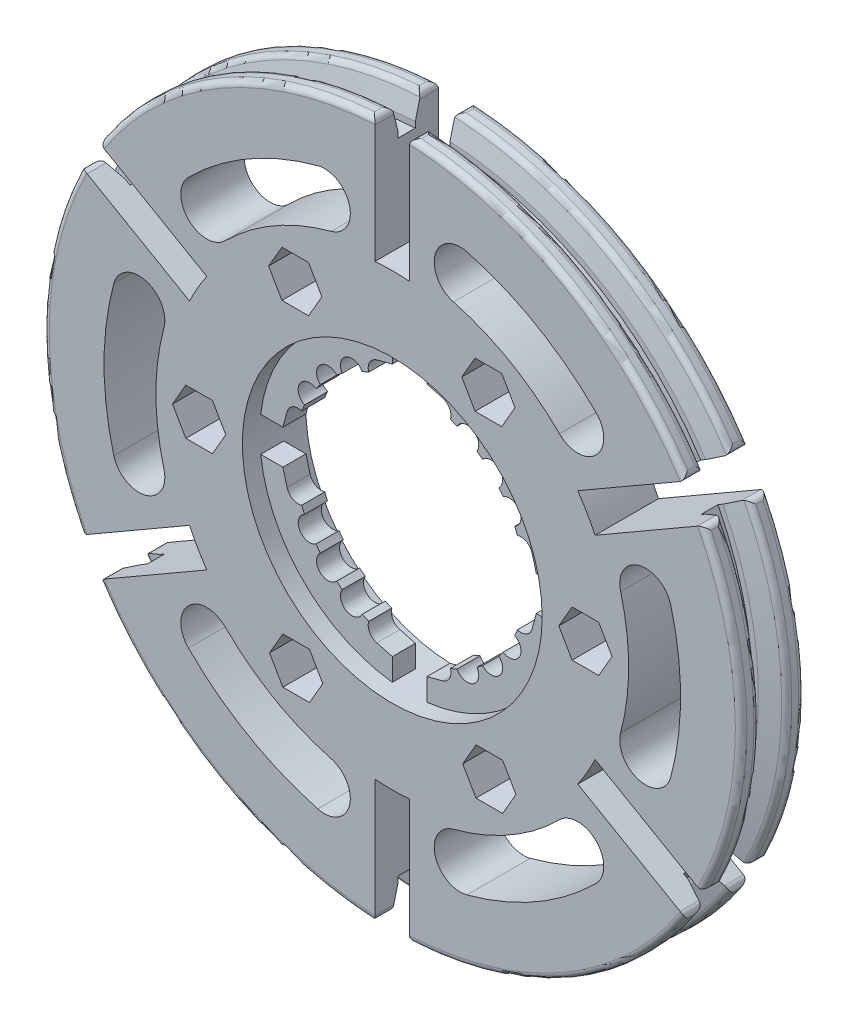
from build123d import *
from OCP.BRepFilletAPI import BRepFilletAPI_MakeChamfer

# Parameters (mm, degrees)
SKETCH_1_R          = 13
EXTRUDE_1_DEPTH     = 5.5
CUT_EXTRUDE_START   = -2
SKETCH_2_R          = 30.25
SKETCH_2_R_2        = 27.75
CUT_EXTRUDE_1_DEPTH = 1.5
CHAMFER_1_SIZE      = 2
CHAMFER_1_SIZE2     = 0.5
CHAMFER_2_SIZE      = 0.5
CHAMFER_2_SIZE2     = 2
FILLET_1_R          = 0.5
CUT_EXTRUDE_2_REACH = 45.085
CUT_EXTRUDE_3_REACH = 45.085
EXTRUDE_START       = -1.5
EXTRUDE_5_DEPTH     = 2
CUT_EXTRUDE_4_REACH = 44.919


with BuildPart() as part:
    # 草图1 → 凸台-拉伸1 (new body)
    with BuildSketch(Plane.XY):
        with BuildLine():
            Line((-1.5, 19.442222095), (-1.5, 30.212787028))
            ThreePointArc((-1.5, 30.212787028), (-15.125, 26.197268464), (-25.415041085, 16.40543162))
            Line((-25.415041085, 16.40543162), (-16.08745824, 11.020149153))
            ThreePointArc((-16.08745824, 11.020149153), (-16.887495374, 9.75), (-17.58745824, 8.422072942))
            Line((-17.58745824, 8.422072942), (-26.915041085, 13.807355408))
            ThreePointArc((-26.915041085, 13.807355408), (-30.25, 0), (-26.915041085, -13.807355408))
            Line((-26.915041085, -13.807355408), (-17.58745824, -8.422072942))
            ThreePointArc((-17.58745824, -8.422072942), (-16.887495374, -9.75), (-16.08745824, -11.020149153))
            Line((-16.08745824, -11.020149153), (-25.415041085, -16.40543162))
            ThreePointArc((-25.415041085, -16.40543162), (-15.125, -26.197268464), (-1.5, -30.212787028))
            Line((-1.5, -30.212787028), (-1.5, -19.442222095))
            ThreePointArc((-1.5, -19.442222095), (0, -19.5), (1.5, -19.442222095))
            Line((1.5, -19.442222095), (1.5, -30.212787028))
            ThreePointArc((1.5, -30.212787028), (15.125, -26.197268464), (25.415041085, -16.40543162))
            Line((25.415041085, -16.40543162), (16.08745824, -11.020149153))
            ThreePointArc((16.08745824, -11.020149153), (16.887495374, -9.75), (17.58745824, -8.422072942))
            Line((17.58745824, -8.422072942), (26.915041085, -13.807355408))
            ThreePointArc((26.915041085, -13.807355408), (30.25, 0), (26.915041085, 13.807355408))
            Line((26.915041085, 13.807355408), (17.58745824, 8.422072942))
            ThreePointArc((17.58745824, 8.422072942), (16.887495374, 9.75), (16.08745824, 11.020149153))
            Line((16.08745824, 11.020149153), (25.415041085, 16.40543162))
            ThreePointArc((25.415041085, 16.40543162), (15.125, 26.197268464), (1.5, 30.212787028))
            Line((1.5, 30.212787028), (1.5, 19.442222095))
            ThreePointArc((1.5, 19.442222095), (0, 19.5), (-1.5, 19.442222095))
        make_face()
        Circle(SKETCH_1_R, mode=Mode.SUBTRACT)
    extrude(amount=-EXTRUDE_1_DEPTH)

    # 草图2 → 切除-拉伸1 (cut)
    with BuildSketch(Plane.XY.offset(CUT_EXTRUDE_START)):
        Circle(SKETCH_2_R)
        Circle(SKETCH_2_R_2, mode=Mode.SUBTRACT)
    extrude(amount=-CUT_EXTRUDE_1_DEPTH, mode=Mode.SUBTRACT)

    # 倒角1: one chamfer whose edges measure the first distance from different faces: ONE call of the kernel's chamfer builder (chamfer() names one face for all edges)
    chamfer_1_edges_1 = [part.edges().sort_by_distance(p)[0] for p in [
        (15.125, -26.197268464, -2),
    ]]
    chamfer_1_side_1 = [part.faces().sort_by_distance(p)[0] for p in [
        (13.977418877, -24.209599654, -2),
    ]]
    chamfer_1_edges_2 = [part.edges().sort_by_distance(p)[0] for p in [
        (-15.125, -26.197268464, -2),
    ]]
    chamfer_1_side_2 = [part.faces().sort_by_distance(p)[0] for p in [
        (-13.977418877, -24.209599654, -2),
    ]]
    chamfer_1_edges_3 = [part.edges().sort_by_distance(p)[0] for p in [
        (-30.25, 0, -2),
    ]]
    chamfer_1_side_3 = [part.faces().sort_by_distance(p)[0] for p in [
        (-27.954837754, 0, -2),
    ]]
    chamfer_1_edges_4 = [part.edges().sort_by_distance(p)[0] for p in [
        (-15.125, 26.197268464, -2),
    ]]
    chamfer_1_side_4 = [part.faces().sort_by_distance(p)[0] for p in [
        (-13.977418877, 24.209599654, -2),
    ]]
    chamfer_1_edges_5 = [part.edges().sort_by_distance(p)[0] for p in [
        (15.125, 26.197268464, -2),
    ]]
    chamfer_1_side_5 = [part.faces().sort_by_distance(p)[0] for p in [
        (13.977418877, 24.209599654, -2),
    ]]
    chamfer_1_edges_6 = [part.edges().sort_by_distance(p)[0] for p in [
        (30.25, 0, -2),
    ]]
    chamfer_1_side_6 = [part.faces().sort_by_distance(p)[0] for p in [
        (27.954837754, 0, -2),
    ]]
    chamfer_1 = BRepFilletAPI_MakeChamfer(part.part.solid().wrapped)
    for e in chamfer_1_edges_1:
        chamfer_1.Add(CHAMFER_1_SIZE, CHAMFER_1_SIZE2, e.wrapped, chamfer_1_side_1[0].wrapped)  # the first distance lies on this face
    for e in chamfer_1_edges_2:
        chamfer_1.Add(CHAMFER_1_SIZE, CHAMFER_1_SIZE2, e.wrapped, chamfer_1_side_2[0].wrapped)  # the first distance lies on this face
    for e in chamfer_1_edges_3:
        chamfer_1.Add(CHAMFER_1_SIZE, CHAMFER_1_SIZE2, e.wrapped, chamfer_1_side_3[0].wrapped)  # the first distance lies on this face
    for e in chamfer_1_edges_4:
        chamfer_1.Add(CHAMFER_1_SIZE, CHAMFER_1_SIZE2, e.wrapped, chamfer_1_side_4[0].wrapped)  # the first distance lies on this face
    for e in chamfer_1_edges_5:
        chamfer_1.Add(CHAMFER_1_SIZE, CHAMFER_1_SIZE2, e.wrapped, chamfer_1_side_5[0].wrapped)  # the first distance lies on this face
    for e in chamfer_1_edges_6:
        chamfer_1.Add(CHAMFER_1_SIZE, CHAMFER_1_SIZE2, e.wrapped, chamfer_1_side_6[0].wrapped)  # the first distance lies on this face
    add(Compound.cast(chamfer_1.Shape()), mode=Mode.REPLACE)

    # 倒角2: one chamfer whose edges measure the first distance from different faces: ONE call of the kernel's chamfer builder (chamfer() names one face for all edges)
    chamfer_2_edges_1 = [part.edges().sort_by_distance(p)[0] for p in [
        (15.125, 26.197268464, -3.5),
    ]]
    chamfer_2_side_1 = [part.faces().sort_by_distance(p)[0] for p in [
        (15.125, 26.197268464, -4.5),
    ]]
    chamfer_2_edges_2 = [part.edges().sort_by_distance(p)[0] for p in [
        (30.25, 0, -3.5),
    ]]
    chamfer_2_side_2 = [part.faces().sort_by_distance(p)[0] for p in [
        (30.25, 0, -4.5),
    ]]
    chamfer_2_edges_3 = [part.edges().sort_by_distance(p)[0] for p in [
        (15.125, -26.197268464, -3.5),
    ]]
    chamfer_2_side_3 = [part.faces().sort_by_distance(p)[0] for p in [
        (15.125, -26.197268464, -4.5),
    ]]
    chamfer_2_edges_4 = [part.edges().sort_by_distance(p)[0] for p in [
        (-15.125, -26.197268464, -3.5),
    ]]
    chamfer_2_side_4 = [part.faces().sort_by_distance(p)[0] for p in [
        (-15.125, -26.197268464, -4.5),
    ]]
    chamfer_2_edges_5 = [part.edges().sort_by_distance(p)[0] for p in [
        (-30.25, 0, -3.5),
    ]]
    chamfer_2_side_5 = [part.faces().sort_by_distance(p)[0] for p in [
        (-30.25, 0, -4.5),
    ]]
    chamfer_2_edges_6 = [part.edges().sort_by_distance(p)[0] for p in [
        (-15.125, 26.197268464, -3.5),
    ]]
    chamfer_2_side_6 = [part.faces().sort_by_distance(p)[0] for p in [
        (-15.125, 26.197268464, -4.5),
    ]]
    chamfer_2 = BRepFilletAPI_MakeChamfer(part.part.solid().wrapped)
    for e in chamfer_2_edges_1:
        chamfer_2.Add(CHAMFER_2_SIZE, CHAMFER_2_SIZE2, e.wrapped, chamfer_2_side_1[0].wrapped)  # the first distance lies on this face
    for e in chamfer_2_edges_2:
        chamfer_2.Add(CHAMFER_2_SIZE, CHAMFER_2_SIZE2, e.wrapped, chamfer_2_side_2[0].wrapped)  # the first distance lies on this face
    for e in chamfer_2_edges_3:
        chamfer_2.Add(CHAMFER_2_SIZE, CHAMFER_2_SIZE2, e.wrapped, chamfer_2_side_3[0].wrapped)  # the first distance lies on this face
    for e in chamfer_2_edges_4:
        chamfer_2.Add(CHAMFER_2_SIZE, CHAMFER_2_SIZE2, e.wrapped, chamfer_2_side_4[0].wrapped)  # the first distance lies on this face
    for e in chamfer_2_edges_5:
        chamfer_2.Add(CHAMFER_2_SIZE, CHAMFER_2_SIZE2, e.wrapped, chamfer_2_side_5[0].wrapped)  # the first distance lies on this face
    for e in chamfer_2_edges_6:
        chamfer_2.Add(CHAMFER_2_SIZE, CHAMFER_2_SIZE2, e.wrapped, chamfer_2_side_6[0].wrapped)  # the first distance lies on this face
    add(Compound.cast(chamfer_2.Shape()), mode=Mode.REPLACE)

    # 圆角1
    fillet_1_edges = [part.edges().sort_by_distance(p)[0] for p in [
        (15.125, 26.197268464, -1.5),
        (15.125, 26.197268464, 0),
        (30.25, 0, -5.5),
        (26.915041085, -13.807355408, -4.75),
        (30.25, 0, -4),
        (26.915041085, 13.807355408, -4.75),
        (15.125, -26.197268464, -5.5),
        (1.5, -30.212787028, -4.75),
        (15.125, -26.197268464, -4),
        (25.415041085, -16.40543162, -4.75),
        (-15.125, -26.197268464, -5.5),
        (-25.415041085, -16.40543162, -4.75),
        (-15.125, -26.197268464, -4),
        (-1.5, -30.212787028, -4.75),
        (-30.25, 0, -5.5),
        (-26.915041085, 13.807355408, -4.75),
        (-30.25, 0, -4),
        (-26.915041085, -13.807355408, -4.75),
        (15.125, 26.197268464, -5.5),
        (25.415041085, 16.40543162, -4.75),
        (15.125, 26.197268464, -4),
        (1.5, 30.212787028, -4.75),
        (-15.125, 26.197268464, -5.5),
        (-1.5, 30.212787028, -4.75),
        (-15.125, 26.197268464, -4),
        (-25.415041085, 16.40543162, -4.75),
        (-15.125, 26.197268464, 0),
        (-25.415041085, 16.40543162, -0.75),
        (-15.125, 26.197268464, -1.5),
        (-1.5, 30.212787028, -0.75),
        (-30.25, 0, 0),
        (-26.915041085, -13.807355408, -0.75),
        (-30.25, 0, -1.5),
        (-26.915041085, 13.807355408, -0.75),
        (-15.125, -26.197268464, 0),
        (-1.5, -30.212787028, -0.75),
        (-15.125, -26.197268464, -1.5),
        (-25.415041085, -16.40543162, -0.75),
        (15.125, -26.197268464, 0),
        (25.415041085, -16.40543162, -0.75),
        (15.125, -26.197268464, -1.5),
        (1.5, -30.212787028, -0.75),
        (30.25, 0, 0),
        (26.915041085, 13.807355408, -0.75),
        (30.25, 0, -1.5),
        (26.915041085, -13.807355408, -0.75),
        (1.5, 30.212787028, -0.75),
        (25.415041085, 16.40543162, -0.75),
    ]]
    fillet(fillet_1_edges, radius=FILLET_1_R)

    # 草图3 → 切除-拉伸2 (cut, up to next)
    with BuildSketch(Plane.XY, mode=Mode.PRIVATE) as cut_extrude_2_sk1:
        with BuildLine():
            ThreePointArc((14.495689014, 14.495689014), (10.25, 17.753520778), (5.305790425, 19.801479439))
            ThreePointArc((5.305790425, 19.801479439), (3.714800167, 22.5571554), (6.470476128, 24.148145657))
            ThreePointArc((6.470476128, 24.148145657), (12.5, 21.650635095), (17.67766953, 17.67766953))
            ThreePointArc((17.67766953, 17.67766953), (17.67766953, 14.495689014), (14.495689014, 14.495689014))
        make_face()
    cut_extrude_2_tool1 = extrude(cut_extrude_2_sk1.sketch, amount=-CUT_EXTRUDE_2_REACH, mode=Mode.PRIVATE) & part.part
    # 草图3 → 切除-拉伸2 (cut, up to next)
    with BuildSketch(Plane.XY, mode=Mode.PRIVATE) as cut_extrude_2_sk2:
        with BuildLine():
            ThreePointArc((19.801479439, -5.305790425), (20.5, 0), (19.801479439, 5.305790425))
            ThreePointArc((19.801479439, 5.305790425), (21.392469697, 8.061466385), (24.148145657, 6.470476128))
            ThreePointArc((24.148145657, 6.470476128), (25, 0), (24.148145657, -6.470476128))
            ThreePointArc((24.148145657, -6.470476128), (21.392469697, -8.061466385), (19.801479439, -5.305790425))
        make_face()
    cut_extrude_2_tool2 = extrude(cut_extrude_2_sk2.sketch, amount=-CUT_EXTRUDE_2_REACH, mode=Mode.PRIVATE) & part.part
    # 草图3 → 切除-拉伸2 (cut, up to next)
    with BuildSketch(Plane.XY, mode=Mode.PRIVATE) as cut_extrude_2_sk3:
        with BuildLine():
            ThreePointArc((5.305790425, -19.801479439), (10.25, -17.753520778), (14.495689014, -14.495689014))
            ThreePointArc((14.495689014, -14.495689014), (17.67766953, -14.495689014), (17.67766953, -17.67766953))
            ThreePointArc((17.67766953, -17.67766953), (12.5, -21.650635095), (6.470476128, -24.148145657))
            ThreePointArc((6.470476128, -24.148145657), (3.714800167, -22.5571554), (5.305790425, -19.801479439))
        make_face()
    cut_extrude_2_tool3 = extrude(cut_extrude_2_sk3.sketch, amount=-CUT_EXTRUDE_2_REACH, mode=Mode.PRIVATE) & part.part
    # 草图3 → 切除-拉伸2 (cut, up to next)
    with BuildSketch(Plane.XY, mode=Mode.PRIVATE) as cut_extrude_2_sk4:
        with BuildLine():
            ThreePointArc((-14.495689014, -14.495689014), (-10.25, -17.753520778), (-5.305790425, -19.801479439))
            ThreePointArc((-5.305790425, -19.801479439), (-3.714800167, -22.5571554), (-6.470476128, -24.148145657))
            ThreePointArc((-6.470476128, -24.148145657), (-12.5, -21.650635095), (-17.67766953, -17.67766953))
            ThreePointArc((-17.67766953, -17.67766953), (-17.67766953, -14.495689014), (-14.495689014, -14.495689014))
        make_face()
    cut_extrude_2_tool4 = extrude(cut_extrude_2_sk4.sketch, amount=-CUT_EXTRUDE_2_REACH, mode=Mode.PRIVATE) & part.part
    # 草图3 → 切除-拉伸2 (cut, up to next)
    with BuildSketch(Plane.XY, mode=Mode.PRIVATE) as cut_extrude_2_sk5:
        with BuildLine():
            ThreePointArc((-19.801479439, 5.305790425), (-20.5, 0), (-19.801479439, -5.305790425))
            ThreePointArc((-19.801479439, -5.305790425), (-21.392469697, -8.061466385), (-24.148145657, -6.470476128))
            ThreePointArc((-24.148145657, -6.470476128), (-25, 0), (-24.148145657, 6.470476128))
            ThreePointArc((-24.148145657, 6.470476128), (-21.392469697, 8.061466385), (-19.801479439, 5.305790425))
        make_face()
    cut_extrude_2_tool5 = extrude(cut_extrude_2_sk5.sketch, amount=-CUT_EXTRUDE_2_REACH, mode=Mode.PRIVATE) & part.part
    # 草图3 → 切除-拉伸2 (cut, up to next)
    with BuildSketch(Plane.XY, mode=Mode.PRIVATE) as cut_extrude_2_sk6:
        with BuildLine():
            ThreePointArc((-5.305790425, 19.801479439), (-10.25, 17.753520778), (-14.495689014, 14.495689014))
            ThreePointArc((-14.495689014, 14.495689014), (-17.67766953, 14.495689014), (-17.67766953, 17.67766953))
            ThreePointArc((-17.67766953, 17.67766953), (-12.5, 21.650635095), (-6.470476128, 24.148145657))
            ThreePointArc((-6.470476128, 24.148145657), (-3.714800167, 22.5571554), (-5.305790425, 19.801479439))
        make_face()
    cut_extrude_2_tool6 = extrude(cut_extrude_2_sk6.sketch, amount=-CUT_EXTRUDE_2_REACH, mode=Mode.PRIVATE) & part.part
    add(cut_extrude_2_tool1.solids().sort_by_distance((11.186449, 19.375499, 0))[0], mode=Mode.SUBTRACT)
    add(cut_extrude_2_tool2.solids().sort_by_distance((22.372899, 0, 0))[0], mode=Mode.SUBTRACT)
    add(cut_extrude_2_tool3.solids().sort_by_distance((11.186449, -19.375499, 0))[0], mode=Mode.SUBTRACT)
    add(cut_extrude_2_tool4.solids().sort_by_distance((-11.186449, -19.375499, 0))[0], mode=Mode.SUBTRACT)
    add(cut_extrude_2_tool5.solids().sort_by_distance((-22.372899, 0, 0))[0], mode=Mode.SUBTRACT)
    add(cut_extrude_2_tool6.solids().sort_by_distance((-11.186449, 19.375499, 0))[0], mode=Mode.SUBTRACT)

    # 草图4 → 切除-拉伸3 (cut, up to next)
    with BuildSketch(Plane.XY, mode=Mode.PRIVATE) as cut_extrude_3_sk1:
        Polygon((9.490232057, 16.528641172), (7.180830981, 16.528641172), (6.026130442, 14.528641172), (7.180830981, 12.528641172), (9.490232057, 12.528641172), (10.644932596, 14.528641172), align=None)
    cut_extrude_3_tool1 = extrude(cut_extrude_3_sk1.sketch, amount=-CUT_EXTRUDE_3_REACH, mode=Mode.PRIVATE) & part.part
    # 草图4 → 切除-拉伸3 (cut, up to next)
    with BuildSketch(Plane.XY, mode=Mode.PRIVATE) as cut_extrude_3_sk2:
        Polygon((-9.569107116, 16.483102635), (-10.723807654, 14.483102635), (-9.569107116, 12.483102635), (-7.259706039, 12.483102635), (-6.105005501, 14.483102635), (-7.259706039, 16.483102635), align=None)
    cut_extrude_3_tool2 = extrude(cut_extrude_3_sk2.sketch, amount=-CUT_EXTRUDE_3_REACH, mode=Mode.PRIVATE) & part.part
    # 草图4 → 切除-拉伸3 (cut, up to next)
    with BuildSketch(Plane.XY, mode=Mode.PRIVATE) as cut_extrude_3_sk3:
        Polygon((19.059339173, 0.045538536), (17.904638635, 2.045538536), (15.595237558, 2.045538536), (14.44053702, 0.045538536), (15.595237558, -1.954461464), (17.904638635, -1.954461464), align=None)
    cut_extrude_3_tool3 = extrude(cut_extrude_3_sk3.sketch, amount=-CUT_EXTRUDE_3_REACH, mode=Mode.PRIVATE) & part.part
    # 草图4 → 切除-拉伸3 (cut, up to next)
    with BuildSketch(Plane.XY, mode=Mode.PRIVATE) as cut_extrude_3_sk4:
        Polygon((9.569107116, -16.483102635), (10.723807654, -14.483102635), (9.569107116, -12.483102635), (7.259706039, -12.483102635), (6.105005501, -14.483102635), (7.259706039, -16.483102635), align=None)
    cut_extrude_3_tool4 = extrude(cut_extrude_3_sk4.sketch, amount=-CUT_EXTRUDE_3_REACH, mode=Mode.PRIVATE) & part.part
    # 草图4 → 切除-拉伸3 (cut, up to next)
    with BuildSketch(Plane.XY, mode=Mode.PRIVATE) as cut_extrude_3_sk5:
        Polygon((-9.490232057, -16.528641172), (-7.180830981, -16.528641172), (-6.026130442, -14.528641172), (-7.180830981, -12.528641172), (-9.490232057, -12.528641172), (-10.644932596, -14.528641172), align=None)
    cut_extrude_3_tool5 = extrude(cut_extrude_3_sk5.sketch, amount=-CUT_EXTRUDE_3_REACH, mode=Mode.PRIVATE) & part.part
    # 草图4 → 切除-拉伸3 (cut, up to next)
    with BuildSketch(Plane.XY, mode=Mode.PRIVATE) as cut_extrude_3_sk6:
        Polygon((-19.059339173, -0.045538536), (-17.904638635, -2.045538536), (-15.595237558, -2.045538536), (-14.44053702, -0.045538536), (-15.595237558, 1.954461464), (-17.904638635, 1.954461464), align=None)
    cut_extrude_3_tool6 = extrude(cut_extrude_3_sk6.sketch, amount=-CUT_EXTRUDE_3_REACH, mode=Mode.PRIVATE) & part.part
    add(cut_extrude_3_tool1.solids().sort_by_distance((8.335532, 14.528641, 0))[0], mode=Mode.SUBTRACT)
    add(cut_extrude_3_tool2.solids().sort_by_distance((-8.414407, 14.483103, 0))[0], mode=Mode.SUBTRACT)
    add(cut_extrude_3_tool3.solids().sort_by_distance((16.749938, 0.045539, 0))[0], mode=Mode.SUBTRACT)
    add(cut_extrude_3_tool4.solids().sort_by_distance((8.414407, -14.483103, 0))[0], mode=Mode.SUBTRACT)
    add(cut_extrude_3_tool5.solids().sort_by_distance((-8.335532, -14.528641, 0))[0], mode=Mode.SUBTRACT)
    add(cut_extrude_3_tool6.solids().sort_by_distance((-16.749938, -0.045539, 0))[0], mode=Mode.SUBTRACT)

    # 草图7 → 凸台-拉伸5 (add)
    with BuildSketch(Plane.XY.offset(EXTRUDE_START)):
        with BuildLine():
            Line((-12.91317157, 1.5), (-9.886859967, 1.5))
            ThreePointArc((-9.886859967, 1.5), (-7.071067812, 7.071067812), (-1.5, 9.886859967))
            Line((-1.5, 9.886859967), (-1.5, 12.91317157))
            ThreePointArc((-1.5, 12.91317157), (-9.192388155, 9.192388155), (-12.91317157, 1.5))
        make_face()
        with BuildLine():
            Line((-1.5, -9.886859967), (-1.5, -12.91317157))
            ThreePointArc((-1.5, -12.91317157), (-9.192388155, -9.192388155), (-12.91317157, -1.5))
            Line((-12.91317157, -1.5), (-9.886859967, -1.5))
            ThreePointArc((-9.886859967, -1.5), (-7.071067812, -7.071067812), (-1.5, -9.886859967))
        make_face()
        with BuildLine():
            Line((1.5, -9.886859967), (1.5, -12.91317157))
            ThreePointArc((1.5, -12.91317157), (9.192388155, -9.192388155), (12.91317157, -1.5))
            Line((12.91317157, -1.5), (9.886859967, -1.5))
            ThreePointArc((9.886859967, -1.5), (7.071067812, -7.071067812), (1.5, -9.886859967))
        make_face()
        with BuildLine():
            Line((9.886859967, 1.5), (12.91317157, 1.5))
            ThreePointArc((12.91317157, 1.5), (9.192388155, 9.192388155), (1.5, 12.91317157))
            Line((1.5, 12.91317157), (1.5, 9.886859967))
            ThreePointArc((1.5, 9.886859967), (7.071067812, 7.071067812), (9.886859967, 1.5))
        make_face()
    extrude(amount=-EXTRUDE_5_DEPTH)

    # 草图8 → 切除-拉伸4 (cut, up to next)
    with BuildSketch(Plane.XY.offset(-1.5), mode=Mode.PRIVATE) as cut_extrude_4_sk1:
        with BuildLine():
            Line((2.847009496, 10.625184089), (1.5, 10.986114196))
            Line((1.5, 10.986114196), (1.5, 9.886859967))
            ThreePointArc((1.5, 9.886859967), (2.534109568, 9.673587168), (3.539967162, 9.352466653))
            ThreePointArc((3.539967162, 9.352466653), (3.466448921, 10.137444482), (2.847009496, 10.625184089))
        make_face()
    cut_extrude_4_tool1 = extrude(cut_extrude_4_sk1.sketch, amount=-CUT_EXTRUDE_4_REACH, mode=Mode.PRIVATE) & part.part
    # 草图8 → 切除-拉伸4 (cut, up to next)
    with BuildSketch(Plane.XY.offset(-1.5), mode=Mode.PRIVATE) as cut_extrude_4_sk2:
        with BuildLine():
            Line((-2.847009496, -10.625184089), (-1.5, -10.986114196))
            Line((-1.5, -10.986114196), (-1.5, -9.886859967))
            ThreePointArc((-1.5, -9.886859967), (-2.534109568, -9.673587168), (-3.539967162, -9.352466653))
            ThreePointArc((-3.539967162, -9.352466653), (-3.466448921, -10.137444482), (-2.847009496, -10.625184089))
        make_face()
    cut_extrude_4_tool2 = extrude(cut_extrude_4_sk2.sketch, amount=-CUT_EXTRUDE_4_REACH, mode=Mode.PRIVATE) & part.part
    # 草图8 → 切除-拉伸4 (cut, up to next)
    with BuildSketch(Plane.XY.offset(-1.5), mode=Mode.PRIVATE) as cut_extrude_4_sk3:
        with BuildLine():
            Line((10.625184089, 2.847009496), (10.986114196, 1.5))
            Line((10.986114196, 1.5), (9.886859967, 1.5))
            ThreePointArc((9.886859967, 1.5), (9.673587168, 2.534109568), (9.352466653, 3.539967162))
            ThreePointArc((9.352466653, 3.539967162), (10.137444482, 3.466448921), (10.625184089, 2.847009496))
        make_face()
    cut_extrude_4_tool3 = extrude(cut_extrude_4_sk3.sketch, amount=-CUT_EXTRUDE_4_REACH, mode=Mode.PRIVATE) & part.part
    # 草图8 → 切除-拉伸4 (cut, up to next)
    with BuildSketch(Plane.XY.offset(-1.5), mode=Mode.PRIVATE) as cut_extrude_4_sk4:
        with BuildLine():
            Line((9.886859967, -1.5), (10.986114196, -1.5))
            Line((10.986114196, -1.5), (10.625184089, -2.847009496))
            ThreePointArc((10.625184089, -2.847009496), (10.137444482, -3.466448921), (9.352466653, -3.539967162))
            ThreePointArc((9.352466653, -3.539967162), (9.673587168, -2.534109568), (9.886859967, -1.5))
        make_face()
    cut_extrude_4_tool4 = extrude(cut_extrude_4_sk4.sketch, amount=-CUT_EXTRUDE_4_REACH, mode=Mode.PRIVATE) & part.part
    # 草图8 → 切除-拉伸4 (cut, up to next)
    with BuildSketch(Plane.XY.offset(-1.5), mode=Mode.PRIVATE) as cut_extrude_4_sk5:
        with BuildLine():
            Line((1.5, -9.886859967), (1.5, -10.986114196))
            Line((1.5, -10.986114196), (2.847009496, -10.625184089))
            ThreePointArc((2.847009496, -10.625184089), (3.466448921, -10.137444482), (3.539967162, -9.352466653))
            ThreePointArc((3.539967162, -9.352466653), (2.534109568, -9.673587168), (1.5, -9.886859967))
        make_face()
    cut_extrude_4_tool5 = extrude(cut_extrude_4_sk5.sketch, amount=-CUT_EXTRUDE_4_REACH, mode=Mode.PRIVATE) & part.part
    # 草图8 → 切除-拉伸4 (cut, up to next)
    with BuildSketch(Plane.XY.offset(-1.5), mode=Mode.PRIVATE) as cut_extrude_4_sk6:
        with BuildLine():
            Line((-10.625184089, -2.847009496), (-10.986114196, -1.5))
            Line((-10.986114196, -1.5), (-9.886859967, -1.5))
            ThreePointArc((-9.886859967, -1.5), (-9.673587168, -2.534109568), (-9.352466653, -3.539967162))
            ThreePointArc((-9.352466653, -3.539967162), (-10.137444482, -3.466448921), (-10.625184089, -2.847009496))
        make_face()
    cut_extrude_4_tool6 = extrude(cut_extrude_4_sk6.sketch, amount=-CUT_EXTRUDE_4_REACH, mode=Mode.PRIVATE) & part.part
    # 草图8 → 切除-拉伸4 (cut, up to next)
    with BuildSketch(Plane.XY.offset(-1.5), mode=Mode.PRIVATE) as cut_extrude_4_sk7:
        with BuildLine():
            Line((-9.886859967, 1.5), (-10.986114196, 1.5))
            Line((-10.986114196, 1.5), (-10.625184089, 2.847009496))
            ThreePointArc((-10.625184089, 2.847009496), (-10.137444482, 3.466448921), (-9.352466653, 3.539967162))
            ThreePointArc((-9.352466653, 3.539967162), (-9.673587168, 2.534109568), (-9.886859967, 1.5))
        make_face()
    cut_extrude_4_tool7 = extrude(cut_extrude_4_sk7.sketch, amount=-CUT_EXTRUDE_4_REACH, mode=Mode.PRIVATE) & part.part
    # 草图8 → 切除-拉伸4 (cut, up to next)
    with BuildSketch(Plane.XY.offset(-1.5), mode=Mode.PRIVATE) as cut_extrude_4_sk8:
        with BuildLine():
            Line((-1.5, 9.886859967), (-1.5, 10.986114196))
            Line((-1.5, 10.986114196), (-2.847009496, 10.625184089))
            ThreePointArc((-2.847009496, 10.625184089), (-3.466448921, 10.137444482), (-3.539967162, 9.352466653))
            ThreePointArc((-3.539967162, 9.352466653), (-2.534109568, 9.673587168), (-1.5, 9.886859967))
        make_face()
    cut_extrude_4_tool8 = extrude(cut_extrude_4_sk8.sketch, amount=-CUT_EXTRUDE_4_REACH, mode=Mode.PRIVATE) & part.part
    # 草图8 → 切除-拉伸4 (cut, up to next)
    with BuildSketch(Plane.XY.offset(-1.5), mode=Mode.PRIVATE) as cut_extrude_4_sk9:
        with BuildLine():
            ThreePointArc((9.116327377, 4.110057805), (8.660254038, 5), (8.117578159, 5.839942195))
            ThreePointArc((8.117578159, 5.839942195), (9.526279442, 5.5), (9.116327377, 4.110057805))
        make_face()
    cut_extrude_4_tool9 = extrude(cut_extrude_4_sk9.sketch, amount=-CUT_EXTRUDE_4_REACH, mode=Mode.PRIVATE) & part.part
    # 草图8 → 切除-拉伸4 (cut, up to next)
    with BuildSketch(Plane.XY.offset(-1.5), mode=Mode.PRIVATE) as cut_extrude_4_sk10:
        with BuildLine():
            ThreePointArc((7.741934817, 6.329490128), (7.778174593, 7.778174593), (6.329490128, 7.741934817))
            ThreePointArc((6.329490128, 7.741934817), (7.071067812, 7.071067812), (7.741934817, 6.329490128))
        make_face()
    cut_extrude_4_tool10 = extrude(cut_extrude_4_sk10.sketch, amount=-CUT_EXTRUDE_4_REACH, mode=Mode.PRIVATE) & part.part
    # 草图8 → 切除-拉伸4 (cut, up to next)
    with BuildSketch(Plane.XY.offset(-1.5), mode=Mode.PRIVATE) as cut_extrude_4_sk11:
        with BuildLine():
            ThreePointArc((5.839942195, 8.117578159), (5.5, 9.526279442), (4.110057805, 9.116327377))
            ThreePointArc((4.110057805, 9.116327377), (5, 8.660254038), (5.839942195, 8.117578159))
        make_face()
    cut_extrude_4_tool11 = extrude(cut_extrude_4_sk11.sketch, amount=-CUT_EXTRUDE_4_REACH, mode=Mode.PRIVATE) & part.part
    # 草图8 → 切除-拉伸4 (cut, up to next)
    with BuildSketch(Plane.XY.offset(-1.5), mode=Mode.PRIVATE) as cut_extrude_4_sk12:
        with BuildLine():
            ThreePointArc((5.839942195, -8.117578159), (5, -8.660254038), (4.110057805, -9.116327377))
            ThreePointArc((4.110057805, -9.116327377), (5.5, -9.526279442), (5.839942195, -8.117578159))
        make_face()
    cut_extrude_4_tool12 = extrude(cut_extrude_4_sk12.sketch, amount=-CUT_EXTRUDE_4_REACH, mode=Mode.PRIVATE) & part.part
    # 草图8 → 切除-拉伸4 (cut, up to next)
    with BuildSketch(Plane.XY.offset(-1.5), mode=Mode.PRIVATE) as cut_extrude_4_sk13:
        with BuildLine():
            ThreePointArc((7.741934817, -6.329490128), (7.071067812, -7.071067812), (6.329490128, -7.741934817))
            ThreePointArc((6.329490128, -7.741934817), (7.778174593, -7.778174593), (7.741934817, -6.329490128))
        make_face()
    cut_extrude_4_tool13 = extrude(cut_extrude_4_sk13.sketch, amount=-CUT_EXTRUDE_4_REACH, mode=Mode.PRIVATE) & part.part
    # 草图8 → 切除-拉伸4 (cut, up to next)
    with BuildSketch(Plane.XY.offset(-1.5), mode=Mode.PRIVATE) as cut_extrude_4_sk14:
        with BuildLine():
            ThreePointArc((9.116327377, -4.110057805), (9.526279442, -5.5), (8.117578159, -5.839942195))
            ThreePointArc((8.117578159, -5.839942195), (8.660254038, -5), (9.116327377, -4.110057805))
        make_face()
    cut_extrude_4_tool14 = extrude(cut_extrude_4_sk14.sketch, amount=-CUT_EXTRUDE_4_REACH, mode=Mode.PRIVATE) & part.part
    # 草图8 → 切除-拉伸4 (cut, up to next)
    with BuildSketch(Plane.XY.offset(-1.5), mode=Mode.PRIVATE) as cut_extrude_4_sk15:
        with BuildLine():
            ThreePointArc((-9.116327377, -4.110057805), (-8.660254038, -5), (-8.117578159, -5.839942195))
            ThreePointArc((-8.117578159, -5.839942195), (-9.526279442, -5.5), (-9.116327377, -4.110057805))
        make_face()
    cut_extrude_4_tool15 = extrude(cut_extrude_4_sk15.sketch, amount=-CUT_EXTRUDE_4_REACH, mode=Mode.PRIVATE) & part.part
    # 草图8 → 切除-拉伸4 (cut, up to next)
    with BuildSketch(Plane.XY.offset(-1.5), mode=Mode.PRIVATE) as cut_extrude_4_sk16:
        with BuildLine():
            ThreePointArc((-7.741934817, -6.329490128), (-7.778174593, -7.778174593), (-6.329490128, -7.741934817))
            ThreePointArc((-6.329490128, -7.741934817), (-7.071067812, -7.071067812), (-7.741934817, -6.329490128))
        make_face()
    cut_extrude_4_tool16 = extrude(cut_extrude_4_sk16.sketch, amount=-CUT_EXTRUDE_4_REACH, mode=Mode.PRIVATE) & part.part
    # 草图8 → 切除-拉伸4 (cut, up to next)
    with BuildSketch(Plane.XY.offset(-1.5), mode=Mode.PRIVATE) as cut_extrude_4_sk17:
        with BuildLine():
            ThreePointArc((-5.839942195, -8.117578159), (-5.5, -9.526279442), (-4.110057805, -9.116327377))
            ThreePointArc((-4.110057805, -9.116327377), (-5, -8.660254038), (-5.839942195, -8.117578159))
        make_face()
    cut_extrude_4_tool17 = extrude(cut_extrude_4_sk17.sketch, amount=-CUT_EXTRUDE_4_REACH, mode=Mode.PRIVATE) & part.part
    # 草图8 → 切除-拉伸4 (cut, up to next)
    with BuildSketch(Plane.XY.offset(-1.5), mode=Mode.PRIVATE) as cut_extrude_4_sk18:
        with BuildLine():
            ThreePointArc((-5.839942195, 8.117578159), (-5, 8.660254038), (-4.110057805, 9.116327377))
            ThreePointArc((-4.110057805, 9.116327377), (-5.5, 9.526279442), (-5.839942195, 8.117578159))
        make_face()
    cut_extrude_4_tool18 = extrude(cut_extrude_4_sk18.sketch, amount=-CUT_EXTRUDE_4_REACH, mode=Mode.PRIVATE) & part.part
    # 草图8 → 切除-拉伸4 (cut, up to next)
    with BuildSketch(Plane.XY.offset(-1.5), mode=Mode.PRIVATE) as cut_extrude_4_sk19:
        with BuildLine():
            ThreePointArc((-7.741934817, 6.329490128), (-7.071067812, 7.071067812), (-6.329490128, 7.741934817))
            ThreePointArc((-6.329490128, 7.741934817), (-7.778174593, 7.778174593), (-7.741934817, 6.329490128))
        make_face()
    cut_extrude_4_tool19 = extrude(cut_extrude_4_sk19.sketch, amount=-CUT_EXTRUDE_4_REACH, mode=Mode.PRIVATE) & part.part
    # 草图8 → 切除-拉伸4 (cut, up to next)
    with BuildSketch(Plane.XY.offset(-1.5), mode=Mode.PRIVATE) as cut_extrude_4_sk20:
        with BuildLine():
            ThreePointArc((-9.116327377, 4.110057805), (-9.526279442, 5.5), (-8.117578159, 5.839942195))
            ThreePointArc((-8.117578159, 5.839942195), (-8.660254038, 5), (-9.116327377, 4.110057805))
        make_face()
    cut_extrude_4_tool20 = extrude(cut_extrude_4_sk20.sketch, amount=-CUT_EXTRUDE_4_REACH, mode=Mode.PRIVATE) & part.part
    add(cut_extrude_4_tool1.solids().sort_by_distance((2.492225, 10.173958, -1.5))[0], mode=Mode.SUBTRACT)
    add(cut_extrude_4_tool2.solids().sort_by_distance((-2.492225, -10.173958, -1.5))[0], mode=Mode.SUBTRACT)
    add(cut_extrude_4_tool3.solids().sort_by_distance((10.173958, 2.492225, -1.5))[0], mode=Mode.SUBTRACT)
    add(cut_extrude_4_tool4.solids().sort_by_distance((10.173958, -2.492225, -1.5))[0], mode=Mode.SUBTRACT)
    add(cut_extrude_4_tool5.solids().sort_by_distance((2.492225, -10.173958, -1.5))[0], mode=Mode.SUBTRACT)
    add(cut_extrude_4_tool6.solids().sort_by_distance((-10.173958, -2.492225, -1.5))[0], mode=Mode.SUBTRACT)
    add(cut_extrude_4_tool7.solids().sort_by_distance((-10.173958, 2.492225, -1.5))[0], mode=Mode.SUBTRACT)
    add(cut_extrude_4_tool8.solids().sort_by_distance((-2.492225, 10.173958, -1.5))[0], mode=Mode.SUBTRACT)
    add(cut_extrude_4_tool9.solids().sort_by_distance((9.019897, 5.20764, -1.5))[0], mode=Mode.SUBTRACT)
    add(cut_extrude_4_tool10.solids().sort_by_distance((7.364715, 7.364715, -1.5))[0], mode=Mode.SUBTRACT)
    add(cut_extrude_4_tool11.solids().sort_by_distance((5.20764, 9.019897, -1.5))[0], mode=Mode.SUBTRACT)
    add(cut_extrude_4_tool12.solids().sort_by_distance((5.20764, -9.019897, -1.5))[0], mode=Mode.SUBTRACT)
    add(cut_extrude_4_tool13.solids().sort_by_distance((7.364715, -7.364715, -1.5))[0], mode=Mode.SUBTRACT)
    add(cut_extrude_4_tool14.solids().sort_by_distance((9.019897, -5.20764, -1.5))[0], mode=Mode.SUBTRACT)
    add(cut_extrude_4_tool15.solids().sort_by_distance((-9.019897, -5.20764, -1.5))[0], mode=Mode.SUBTRACT)
    add(cut_extrude_4_tool16.solids().sort_by_distance((-7.364715, -7.364715, -1.5))[0], mode=Mode.SUBTRACT)
    add(cut_extrude_4_tool17.solids().sort_by_distance((-5.20764, -9.019897, -1.5))[0], mode=Mode.SUBTRACT)
    add(cut_extrude_4_tool18.solids().sort_by_distance((-5.20764, 9.019897, -1.5))[0], mode=Mode.SUBTRACT)
    add(cut_extrude_4_tool19.solids().sort_by_distance((-7.364715, 7.364715, -1.5))[0], mode=Mode.SUBTRACT)
    add(cut_extrude_4_tool20.solids().sort_by_distance((-9.019897, 5.20764, -1.5))[0], mode=Mode.SUBTRACT)


solid = part.part
